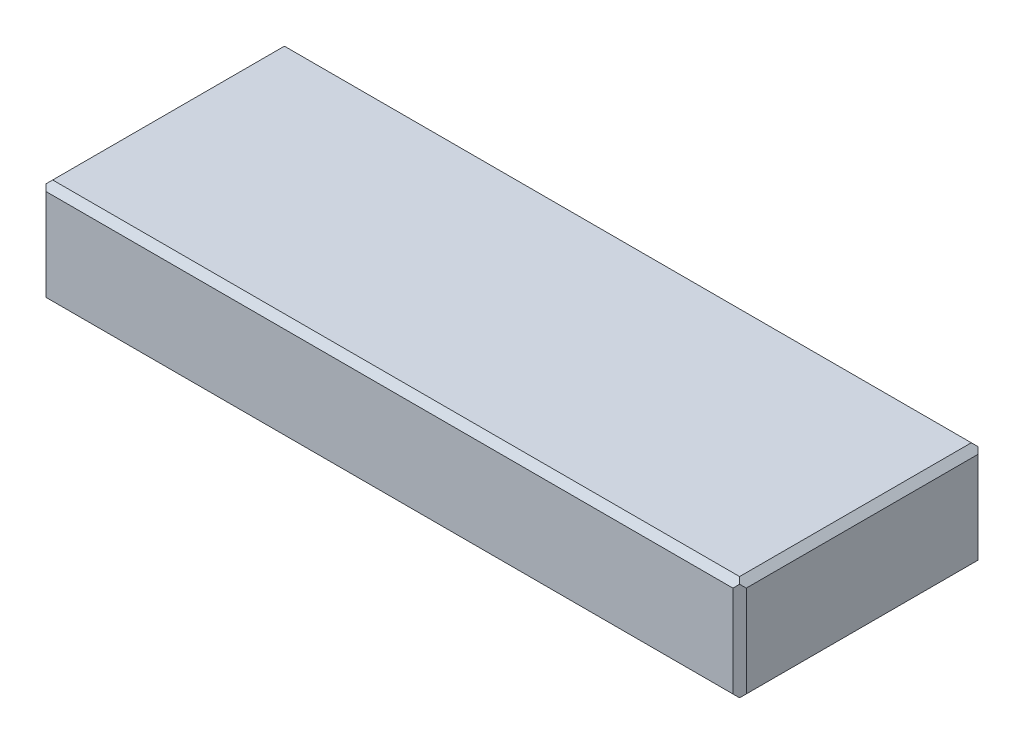
from build123d import *

# Parameters (mm, degrees)
ESQUISSE1_W      = 210
ESQUISSE1_H      = 31.5
EXTRUSION1_DEPTH = 73.5
CHANFREIN1_SIZE  = 2
CHANFREIN2_SIZE  = 2
CHANFREIN3_SIZE  = 2


with BuildPart() as part:
    # Esquisse1 → Extrusion1 (new body)
    with BuildSketch(Plane.XY):
        with Locations((55.878134685, 13.401054852)):
            Rectangle(ESQUISSE1_W, ESQUISSE1_H)
    extrude(amount=EXTRUSION1_DEPTH)

    # Chanfrein1
    chanfrein1_edges = [part.edges().sort_by_distance(p)[0] for p in [
        (55.878134685, -2.348945148, 0),
        (55.878134685, -2.348945148, 73.5),
        (160.878134685, -2.348945148, 36.75),
        (-49.121865315, -2.348945148, 36.75),
    ]]
    chamfer(chanfrein1_edges, length=CHANFREIN1_SIZE)

    # Chanfrein2
    chanfrein2_edges = [part.edges().sort_by_distance(p)[0] for p in [
        (55.878134685, 29.151054852, 73.5),
        (55.878134685, 29.151054852, 0),
        (-49.121865315, 29.151054852, 36.75),
        (160.878134685, 29.151054852, 36.75),
    ]]
    chamfer(chanfrein2_edges, length=CHANFREIN2_SIZE)

    # Chanfrein3
    chanfrein3_edges = [part.edges().sort_by_distance(p)[0] for p in [
        (160.878134685, 13.401054852, 0),
        (160.878134685, 13.401054852, 73.5),
        (-49.121865315, 13.401054852, 0),
        (-49.121865315, 13.401054852, 73.5),
    ]]
    chamfer(chanfrein3_edges, length=CHANFREIN3_SIZE)


solid = part.part
